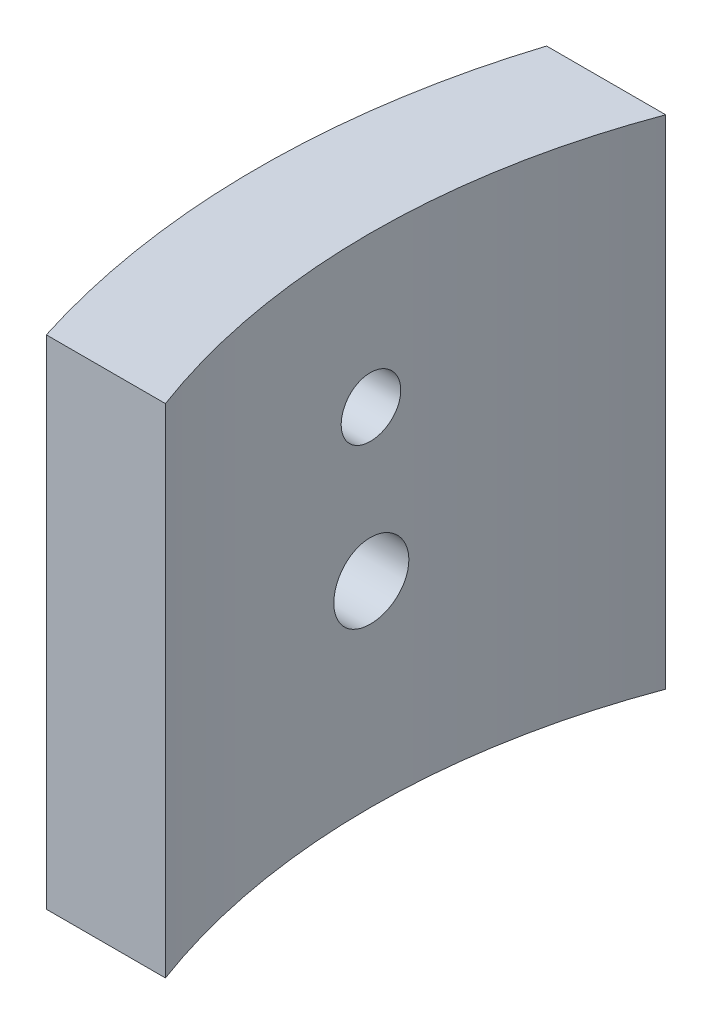
from build123d import *

# Parameters (mm, degrees)
BOSS_EXTRUDE1_DEPTH     = 38.1
SKETCH2_R               = 4.7625
SKETCH2_R_2             = 1.5875
BOSS_EXTRUDE3_DEPTH     = 2.409836439
CUT_EXTRUDE1_START      = -11.579198
CUT_EXTRUDE1_DEPTH      = 11.579198
SKETCH5_R               = 1.5875
CUT_EXTRUDE4_DEPTH      = 42.305774048
CUT_EXTRUDE5_REACH      = 43.306
CUT_EXTRUDE5_END_RADIUS = 44.104394081
SKETCH6_R               = 2


with BuildPart() as part:
    # Sketch1 → Boss-Extrude1 (new body)
    with BuildSketch(Plane(origin=(0, 0, 0), x_dir=(1, 0, 0), z_dir=(0, 1, 0))):
        with BuildLine():
            Line((-42.040163561, -13.335), (-35.690163561, -13.335))
            ThreePointArc((-35.690163561, -13.335), (-38.1, 0), (-35.690163561, 13.335))
            Line((-35.690163561, 13.335), (-42.040163561, 13.335))
            ThreePointArc((-42.040163561, 13.335), (-44.104394081, 0), (-42.040163561, -13.335))
        make_face()
    extrude(amount=BOSS_EXTRUDE1_DEPTH)

    # Sketch2 → Boss-Extrude3 (add)
    with BuildSketch(Plane.ZY.offset(42.040163561)):
        with Locations(Location((0, 30.070397704, 0), (0, 0, 180))):
            Circle(SKETCH2_R)
        with Locations(Location((0, 30.070397704, 0), (0, 0, 180))):
            Circle(SKETCH2_R_2, mode=Mode.SUBTRACT)
    extrude(amount=BOSS_EXTRUDE3_DEPTH)

    # Sketch3 → Cut-Extrude1 (cut)
    with BuildSketch(Plane.XZ.offset(CUT_EXTRUDE1_START)):
        with BuildLine():
            Line((-42.040163561, 13.335), (-35.690163561, 13.335))
            ThreePointArc((-35.690163561, 13.335), (-38.1, 0), (-35.690163561, -13.335))
            Line((-35.690163561, -13.335), (-42.040163561, -13.335))
            ThreePointArc((-42.040163561, -13.335), (-44.104394081, 0), (-42.040163561, 13.335))
        make_face()
    extrude(amount=CUT_EXTRUDE1_DEPTH, mode=Mode.SUBTRACT)

    # Sketch5 → Cut-Extrude4 (cut, through all)
    with BuildSketch(Plane.ZY.offset(44.45)):
        with Locations((0, 30.070397704)):
            Circle(SKETCH5_R)
    extrude(amount=-CUT_EXTRUDE4_DEPTH, mode=Mode.SUBTRACT)

    # Cut-Extrude5: up to this cylinder (the profile starts inside it)
    cut_extrude5_end = Plane(origin=(0, 22.045398, 0), z_dir=(0, -1, 0)) * Cylinder(CUT_EXTRUDE5_END_RADIUS, 175.820788161, mode=Mode.PRIVATE)
    # Sketch6 → Cut-Extrude5 (cut, up to the surface)
    with BuildSketch(Plane(origin=(-35.690163561, 0, 0), x_dir=(0, 0, -1), z_dir=(1, 0, 0)), mode=Mode.PRIVATE) as cut_extrude5_sk1:
        with Locations((0, 22.045397704)):
            Circle(SKETCH6_R)
    cut_extrude5_tool1 = extrude(cut_extrude5_sk1.sketch, amount=-CUT_EXTRUDE5_REACH, mode=Mode.PRIVATE) & cut_extrude5_end
    add(cut_extrude5_tool1.solids().sort_by_distance((-35.690164, 22.045398, 0))[0], mode=Mode.SUBTRACT)


solid = part.part
